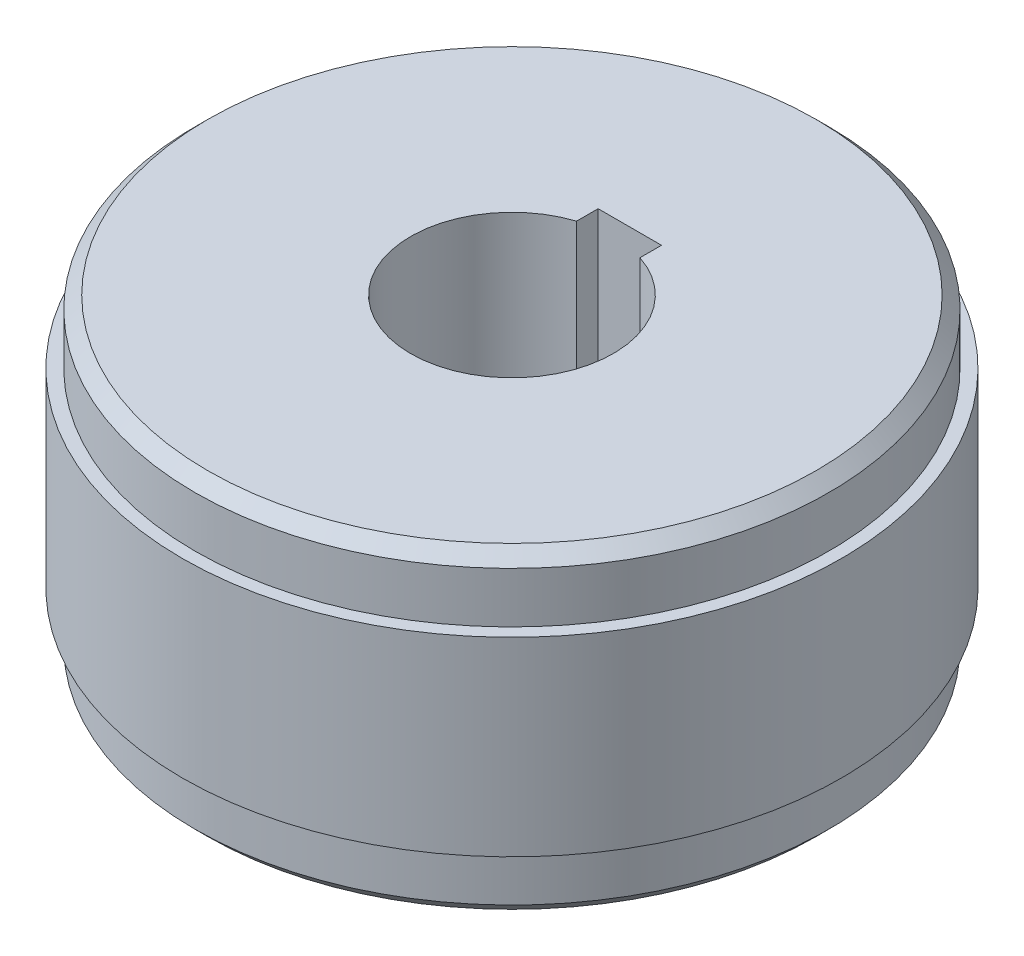
from build123d import *

# Parameters (mm, degrees)
SKETCH_1_R      = 25
EXTRUDE_1_DEPTH = 12.5
SKETCH_2_R      = 26
SKETCH_2_R_2    = 24
EXTRUDE_2_DEPTH = 7.5
CHAMFER_1_SIZE  = 1


with BuildPart() as part:
    # 草图1 → 凸台-拉伸1 (new, symmetric)
    with BuildSketch(Plane(origin=(0, 0, 0), x_dir=(1, 0, 0), z_dir=(0, 1, 0))):
        with Locations(Location((0, 0, 0), (0, 0, 270))):
            Circle(SKETCH_1_R)
        with BuildLine():
            Line((-2.5, 7.599342077), (-2.5, 9.3))
            Line((-2.5, 9.3), (2.5, 9.3))
            Line((2.5, 9.3), (2.5, 7.599342077))
            ThreePointArc((2.5, 7.599342077), (0, -8), (-2.5, 7.599342077))
        make_face(mode=Mode.SUBTRACT)
    extrude(amount=EXTRUDE_1_DEPTH, both=True)

    # 草图2 → 凸台-拉伸2 (add, symmetric)
    with BuildSketch(Plane(origin=(0, 0, 0), x_dir=(1, 0, 0), z_dir=(0, 1, 0))):
        with Locations(Location((0, 0, 0), (0, 0, 270))):
            Circle(SKETCH_2_R)
        Circle(SKETCH_2_R_2, mode=Mode.SUBTRACT)
    extrude(amount=EXTRUDE_2_DEPTH, both=True)

    # 倒角1
    chamfer_1_edges = [part.edges().sort_by_distance(p)[0] for p in [
        (0, -12.5, -25),
        (0, 12.5, -25),
    ]]
    chamfer(chamfer_1_edges, length=CHAMFER_1_SIZE)


solid = part.part
